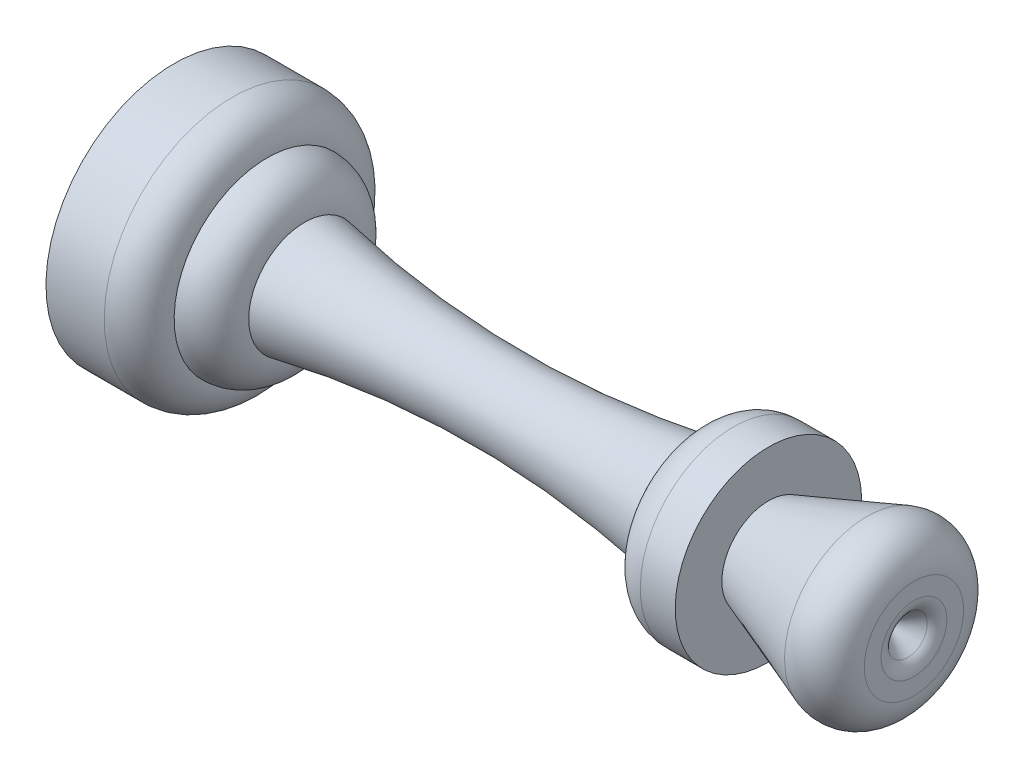
from build123d import *


with BuildPart() as part:
    # Эскиз1 → Повернуть1 (revolve)
    with BuildSketch(Plane.XY):
        with BuildLine():
            Line((0, 11), (0, 0))
            Line((0, 0), (5, 0))
            ThreePointArc((5, 0), (7.121320344, 0.878679656), (8, 3))
            ThreePointArc((8, 3), (10.2627417, 3.9372583), (11.2, 6.2))
            ThreePointArc((11.2, 6.2), (28, 7.8), (44.8, 6.2))
            ThreePointArc((44.8, 6.2), (45.7372583, 3.9372583), (48, 3))
            Line((48, 3), (51, 3))
            Line((51, 3), (51, 7))
            Line((51, 7), (59.457233587, 3.92181871))
            ThreePointArc((59.457233587, 3.92181871), (62.204023326, 4.28344044), (63.483294017, 6.740896572))
            Line((63.483294017, 6.740896572), (63.483294017, 8.174747022))
            ThreePointArc((63.483294017, 8.174747022), (63.342755698, 8.808674415), (62.947475432, 9.323813687))
            Line((62.947475432, 9.323813687), (60.949874371, 11))
            Line((60.949874371, 11), (0, 11))
        make_face()
    revolve(axis=Axis((0, 11, 0), (1, 0, 0)))


solid = part.part
